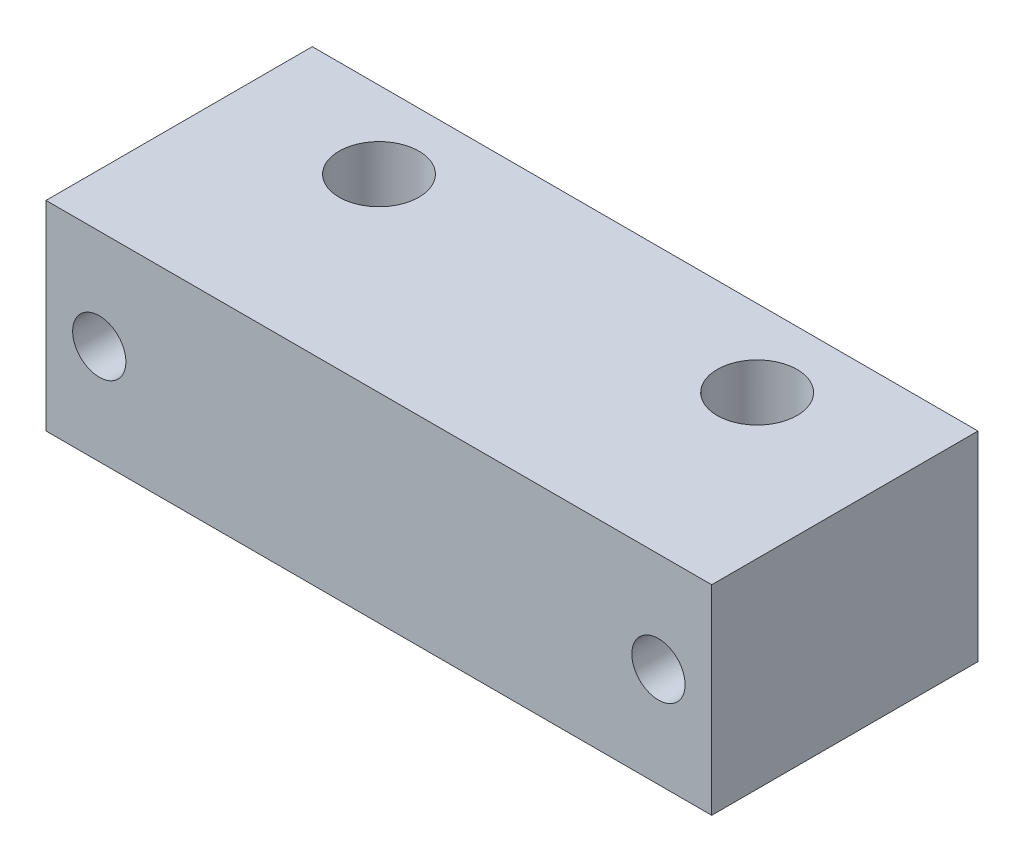
from build123d import *

# Parameters (mm, degrees)
ESBO_O1_W                = 50
ESBO_O1_H                = 20
ESBO_O1_R                = 3
RESSALTO_EXTRUS_O1_DEPTH = 15
ESBO_O2_R                = 2
CORTE_EXTRUS_O1_DEPTH    = 56.402686144
ESBO_O3_R                = 2
CORTE_EXTRUS_O2_DEPTH    = 4


with BuildPart() as part:
    # Esboço1 → Ressalto-extrusão1 (new body)
    with BuildSketch(Plane(origin=(0, 0, 0), x_dir=(1, 0, 0), z_dir=(0, 1, 0))):
        with Locations((24.441456613, 31)):
            Rectangle(ESBO_O1_W, ESBO_O1_H)
        with Locations(Location((10.241456613, 35.210777548, 0), (0, 0, 270))):
            Circle(ESBO_O1_R, mode=Mode.SUBTRACT)
        with Locations(Location((38.641456613, 35.210777548, 0), (0, 0, 270))):
            Circle(ESBO_O1_R, mode=Mode.SUBTRACT)
    extrude(amount=RESSALTO_EXTRUS_O1_DEPTH)

    # Esboço2 → Corte-extrusão1 (cut, through all)
    with BuildSketch(Plane(origin=(0, 0, -41), x_dir=(-1, 0, 0), z_dir=(0, 0, -1))):
        with Locations((-3.441456613, 7.5)):
            Circle(ESBO_O2_R)
        with Locations((-45.441456613, 7.5)):
            Circle(ESBO_O2_R)
    extrude(amount=-CORTE_EXTRUS_O1_DEPTH, mode=Mode.SUBTRACT)

    # Esboço3 → Corte-extrusão2 (cut)
    with BuildSketch(Plane(origin=(0, 0, -41), x_dir=(-1, 0, 0), z_dir=(0, 0, -1))):
        with Locations((-10.241456613, 7.5)):
            Circle(ESBO_O3_R)
        with Locations((-38.641456613, 7.5)):
            Circle(ESBO_O3_R)
    extrude(amount=-CORTE_EXTRUS_O2_DEPTH, mode=Mode.SUBTRACT)


solid = part.part
